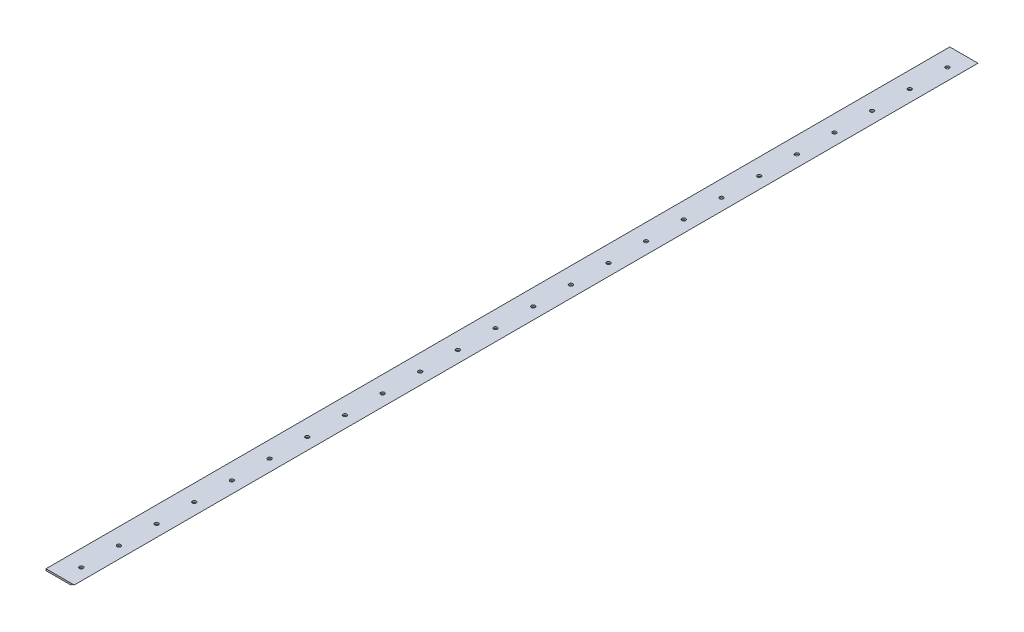
from build123d import *

# Parameters (mm, degrees)
BOSS_EXTRUDE3_DEPTH    = 609.6
F_10_CLEARANCE_HOLE3_D = 5.1054
LPATTERN1_COUNT        = 24
LPATTERN1_PITCH        = 50.8


with BuildPart() as part:
    # Sketch1<4> → Boss-Extrude3 (new, symmetric)
    with BuildSketch(Plane.XY):
        with BuildLine():
            ThreePointArc((-4.443185344, 8.636), (-2.498384078, 10.316985791), (0, 10.922))
            Line((0, 10.922), (-38.1, 10.922))
            Line((-38.1, 10.922), (-38.1, 8.636))
            Line((-38.1, 8.636), (-4.443185344, 8.636))
        make_face()
    extrude(amount=BOSS_EXTRUDE3_DEPTH, both=True)

    # #10 Clearance Hole3 (through all)
    with Locations(Plane(origin=(0, 10.922, 0), x_dir=(1, 0, 0), z_dir=(0, 1, 0))):
        with Locations((-15.875, -584.2)):
            f_10_clearance_hole3 = Hole(F_10_CLEARANCE_HOLE3_D / 2)

    # LPattern1: #10 Clearance Hole3 ×24
    with Locations(*[(0, 0, -i * LPATTERN1_PITCH) for i in range(1, LPATTERN1_COUNT)]):
        add(f_10_clearance_hole3, mode=Mode.SUBTRACT)


solid = part.part
